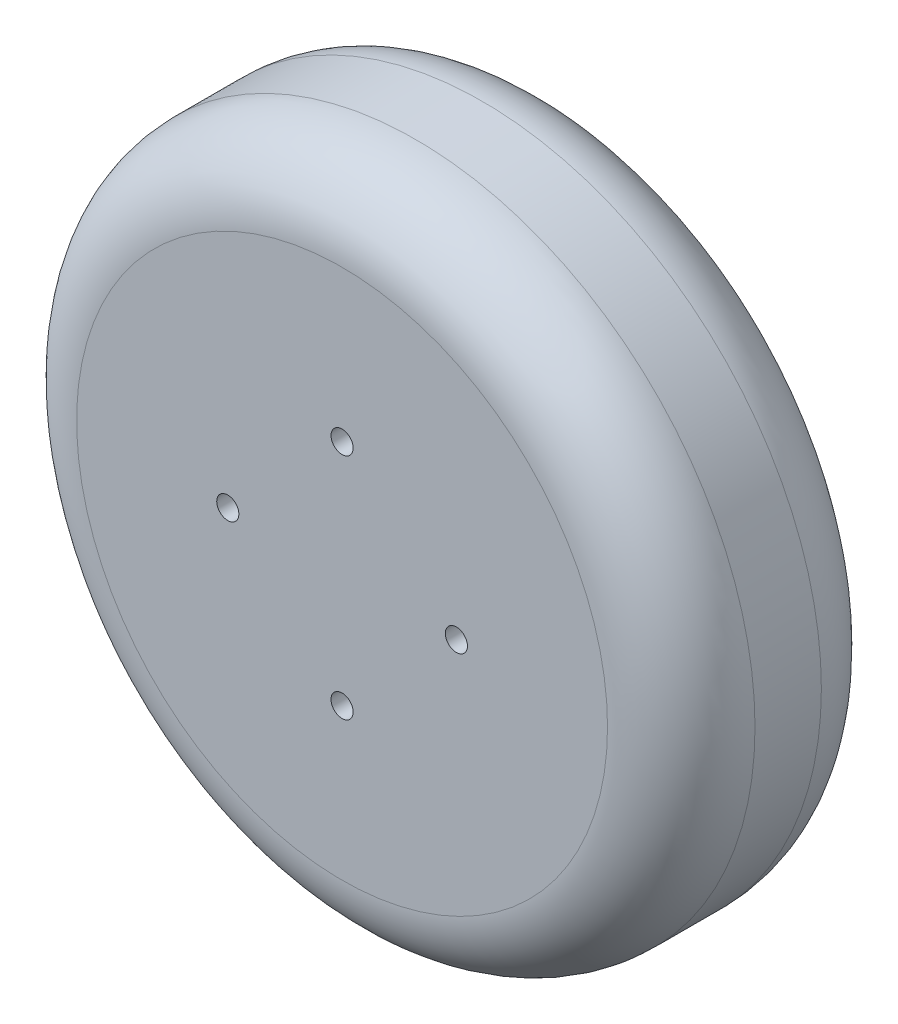
from build123d import *

# Parameters (mm, degrees)
SKETCH_1_R      = 46
SKETCH_1_R_2    = 1.5
EXTRUDE_1_DEPTH = 29
FILLET_1_R      = 10
FILLET_2_R      = 10


with BuildPart() as part:
    # 草图1 → 凸台-拉伸1 (new body)
    with BuildSketch(Plane.XY):
        with Locations(Location((0, 0, 0), (0, 0, 180))):
            Circle(SKETCH_1_R)
        with Locations(Location((0, -15.5, 0), (0, 0, 180))):
            Circle(SKETCH_1_R_2, mode=Mode.SUBTRACT)
        with Locations(Location((-15.5, 0, 0), (0, 0, 180))):
            Circle(SKETCH_1_R_2, mode=Mode.SUBTRACT)
        with Locations(Location((0, 15.5, 0), (0, 0, 180))):
            Circle(SKETCH_1_R_2, mode=Mode.SUBTRACT)
        with Locations(Location((15.5, 0, 0), (0, 0, 180))):
            Circle(SKETCH_1_R_2, mode=Mode.SUBTRACT)
    extrude(amount=EXTRUDE_1_DEPTH)

    # 圆角1
    fillet_1_edges = [part.edges().sort_by_distance(p)[0] for p in [
        (46, 0, 29),
    ]]
    fillet(fillet_1_edges, radius=FILLET_1_R)

    # 圆角2
    fillet_2_edges = [part.edges().sort_by_distance(p)[0] for p in [
        (46, 0, 0),
    ]]
    fillet(fillet_2_edges, radius=FILLET_2_R)


solid = part.part
